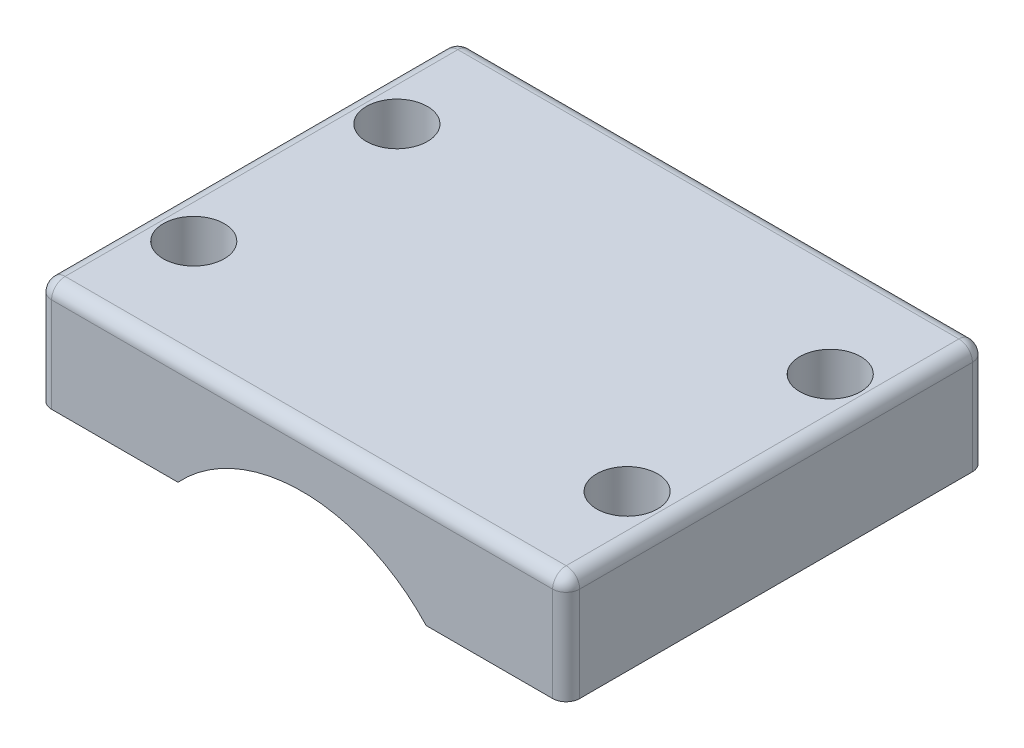
from build123d import *

# Parameters (mm, degrees)
SKETCH1_W           = 39
SKETCH1_H           = 31
SKETCH1_R           = 2.25
BOSS_EXTRUDE1_DEPTH = 8
FILLET2_R           = 1
CUT_EXTRUDE1_DEPTH  = 31


with BuildPart() as part:
    # Sketch1 → Boss-Extrude1 (new body)
    with BuildSketch(Plane(origin=(0, 0, 0), x_dir=(1, 0, 0), z_dir=(0, 1, 0))):
        with Locations((19.5, 15.5)):
            Rectangle(SKETCH1_W, SKETCH1_H)
        with Locations(Location((35.5, 23, 0), (0, 0, 270))):
            Circle(SKETCH1_R, mode=Mode.SUBTRACT)
        with Locations(Location((35.5, 8, 0), (0, 0, 90))):
            Circle(SKETCH1_R, mode=Mode.SUBTRACT)
        with Locations(Location((3.5, 23, 0), (0, 0, 90))):
            Circle(SKETCH1_R, mode=Mode.SUBTRACT)
        with Locations(Location((3.5, 8, 0), (0, 0, 270))):
            Circle(SKETCH1_R, mode=Mode.SUBTRACT)
    extrude(amount=BOSS_EXTRUDE1_DEPTH)

    # Fillet2
    fillet2_edges = [part.edges().sort_by_distance(p)[0] for p in [
        (39, 8, -15.5),
        (19.5, 8, -31),
        (0, 8, -15.5),
        (19.5, 8, 0),
        (0, 4, -31),
        (39, 4, -31),
        (39, 4, 0),
        (0, 4, 0),
    ]]
    fillet(fillet2_edges, radius=FILLET2_R)

    # Sketch2 → Cut-Extrude1 (cut)
    with BuildSketch(Plane.XY):
        with BuildLine():
            Line((10.33484861, 0), (-5.5, 0))
            Line((-5.5, 0), (-5.5, -10))
            Line((-5.5, -10), (44.5, -10))
            Line((44.5, -10), (44.5, 0))
            Line((44.5, 0), (28.66515139, 0))
            ThreePointArc((28.66515139, 0), (19.5, 4), (10.33484861, 0))
        make_face()
    extrude(amount=-CUT_EXTRUDE1_DEPTH, mode=Mode.SUBTRACT)


solid = part.part
